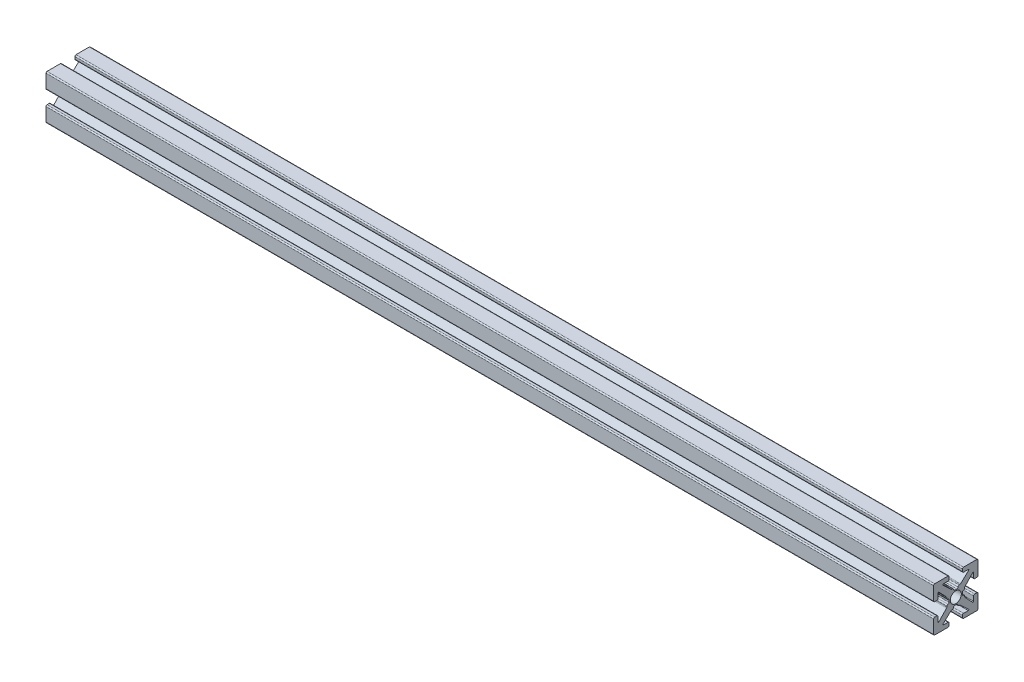
from build123d import *

# Parameters (mm, degrees)
ESTRUSIONE_ESTRUSIONE1_DEPTH = 200
FORO_FILETTATO_M3X0_5_1_D    = 2.5


with BuildPart() as part:
    # Sketch1 → Estrusione-Estrusione1 (new body)
    with BuildSketch(Plane(origin=(0, 0, 0), x_dir=(0, 0, -1), z_dir=(1, 0, 0))):
        with BuildLine():
            Line((-0.2413, 1.4986), (0.2413, 1.4986))
            ThreePointArc((0.2413, 1.4986), (0.420905122, 1.572994878), (0.4953, 1.7526))
            ThreePointArc((0.4953, 1.7526), (0.569694878, 1.932205122), (0.7493, 2.0066))
            Line((0.7493, 2.0066), (0.889923986, 2.0066))
            ThreePointArc((0.889923986, 2.0066), (0.983516259, 2.024471886), (1.063937899, 2.075572548))
            Line((1.063937899, 2.075572548), (2.890793, 3.793686274))
            ThreePointArc((2.890793, 3.793686274), (2.921850101, 3.932996137), (2.803786044, 4.0132))
            Line((2.803786044, 4.0132), (1.7526, 4.0132))
            ThreePointArc((1.7526, 4.0132), (1.572994878, 4.087594878), (1.4986, 4.2672))
            Line((1.4986, 4.2672), (1.4986, 4.7498))
            ThreePointArc((1.4986, 4.7498), (1.572994878, 4.929405122), (1.7526, 5.0038))
            Line((1.7526, 5.0038), (4.7498, 5.0038))
            ThreePointArc((4.7498, 5.0038), (4.929405122, 4.929405122), (5.0038, 4.7498))
            Line((5.0038, 4.7498), (5.0038, 1.7526))
            ThreePointArc((5.0038, 1.7526), (4.929405122, 1.572994878), (4.7498, 1.4986))
            Line((4.7498, 1.4986), (4.2672, 1.4986))
            ThreePointArc((4.2672, 1.4986), (4.087594878, 1.572994878), (4.0132, 1.7526))
            Line((4.0132, 1.7526), (4.0132, 2.803786044))
            ThreePointArc((4.0132, 2.803786044), (3.932996137, 2.921850101), (3.793686274, 2.890793))
            Line((3.793686274, 2.890793), (2.075572548, 1.063937899))
            ThreePointArc((2.075572548, 1.063937899), (2.024471886, 0.983516259), (2.0066, 0.889923986))
            Line((2.0066, 0.889923986), (2.0066, 0.7493))
            ThreePointArc((2.0066, 0.7493), (1.932205122, 0.569694878), (1.7526, 0.4953))
            ThreePointArc((1.7526, 0.4953), (1.572994878, 0.420905122), (1.4986, 0.2413))
            Line((1.4986, 0.2413), (1.4986, -0.2413))
            ThreePointArc((1.4986, -0.2413), (1.572994878, -0.420905122), (1.7526, -0.4953))
            ThreePointArc((1.7526, -0.4953), (1.932205122, -0.569694878), (2.0066, -0.7493))
            Line((2.0066, -0.7493), (2.0066, -0.889923986))
            ThreePointArc((2.0066, -0.889923986), (2.024471886, -0.983516259), (2.075572548, -1.063937899))
            Line((2.075572548, -1.063937899), (3.793686274, -2.890793))
            ThreePointArc((3.793686274, -2.890793), (3.932996137, -2.921850101), (4.0132, -2.803786044))
            Line((4.0132, -2.803786044), (4.0132, -1.7526))
            ThreePointArc((4.0132, -1.7526), (4.087594878, -1.572994878), (4.2672, -1.4986))
            Line((4.2672, -1.4986), (4.7498, -1.4986))
            ThreePointArc((4.7498, -1.4986), (4.929405122, -1.572994878), (5.0038, -1.7526))
            Line((5.0038, -1.7526), (5.0038, -4.7498))
            ThreePointArc((5.0038, -4.7498), (4.929405122, -4.929405122), (4.7498, -5.0038))
            Line((4.7498, -5.0038), (1.7526, -5.0038))
            ThreePointArc((1.7526, -5.0038), (1.572994878, -4.929405122), (1.4986, -4.7498))
            Line((1.4986, -4.7498), (1.4986, -4.2672))
            ThreePointArc((1.4986, -4.2672), (1.572994878, -4.087594878), (1.7526, -4.0132))
            Line((1.7526, -4.0132), (2.803786044, -4.0132))
            ThreePointArc((2.803786044, -4.0132), (2.921850101, -3.932996137), (2.890793, -3.793686274))
            Line((2.890793, -3.793686274), (1.063937899, -2.075572548))
            ThreePointArc((1.063937899, -2.075572548), (0.983516259, -2.024471886), (0.889923986, -2.0066))
            Line((0.889923986, -2.0066), (0.7493, -2.0066))
            ThreePointArc((0.7493, -2.0066), (0.569694878, -1.932205122), (0.4953, -1.7526))
            ThreePointArc((0.4953, -1.7526), (0.420905122, -1.572994878), (0.2413, -1.4986))
            Line((0.2413, -1.4986), (-0.2413, -1.4986))
            ThreePointArc((-0.2413, -1.4986), (-0.420905122, -1.572994878), (-0.4953, -1.7526))
            ThreePointArc((-0.4953, -1.7526), (-0.569694878, -1.932205122), (-0.7493, -2.0066))
            Line((-0.7493, -2.0066), (-0.889923986, -2.0066))
            ThreePointArc((-0.889923986, -2.0066), (-0.983516259, -2.024471886), (-1.063937899, -2.075572548))
            Line((-1.063937899, -2.075572548), (-2.890793, -3.793686274))
            ThreePointArc((-2.890793, -3.793686274), (-2.921850101, -3.932996137), (-2.803786044, -4.0132))
            Line((-2.803786044, -4.0132), (-1.7526, -4.0132))
            ThreePointArc((-1.7526, -4.0132), (-1.572994878, -4.087594878), (-1.4986, -4.2672))
            Line((-1.4986, -4.2672), (-1.4986, -4.7498))
            ThreePointArc((-1.4986, -4.7498), (-1.572994878, -4.929405122), (-1.7526, -5.0038))
            Line((-1.7526, -5.0038), (-4.7498, -5.0038))
            ThreePointArc((-4.7498, -5.0038), (-4.929405122, -4.929405122), (-5.0038, -4.7498))
            Line((-5.0038, -4.7498), (-5.0038, -1.7526))
            ThreePointArc((-5.0038, -1.7526), (-4.929405122, -1.572994878), (-4.7498, -1.4986))
            Line((-4.7498, -1.4986), (-4.2672, -1.4986))
            ThreePointArc((-4.2672, -1.4986), (-4.087594878, -1.572994878), (-4.0132, -1.7526))
            Line((-4.0132, -1.7526), (-4.0132, -2.803786044))
            ThreePointArc((-4.0132, -2.803786044), (-3.932996137, -2.921850101), (-3.793686274, -2.890793))
            Line((-3.793686274, -2.890793), (-2.075572548, -1.063937899))
            ThreePointArc((-2.075572548, -1.063937899), (-2.024471886, -0.983516259), (-2.0066, -0.889923986))
            Line((-2.0066, -0.889923986), (-2.0066, -0.7493))
            ThreePointArc((-2.0066, -0.7493), (-1.932205122, -0.569694878), (-1.7526, -0.4953))
            ThreePointArc((-1.7526, -0.4953), (-1.572994878, -0.420905122), (-1.4986, -0.2413))
            Line((-1.4986, -0.2413), (-1.4986, 0.2413))
            ThreePointArc((-1.4986, 0.2413), (-1.572994878, 0.420905122), (-1.7526, 0.4953))
            ThreePointArc((-1.7526, 0.4953), (-1.932205122, 0.569694878), (-2.0066, 0.7493))
            Line((-2.0066, 0.7493), (-2.0066, 0.889923986))
            ThreePointArc((-2.0066, 0.889923986), (-2.024471886, 0.983516259), (-2.075572548, 1.063937899))
            Line((-2.075572548, 1.063937899), (-3.793686274, 2.890793))
            ThreePointArc((-3.793686274, 2.890793), (-3.932996137, 2.921850101), (-4.0132, 2.803786044))
            Line((-4.0132, 2.803786044), (-4.0132, 1.7526))
            ThreePointArc((-4.0132, 1.7526), (-4.087594878, 1.572994878), (-4.2672, 1.4986))
            Line((-4.2672, 1.4986), (-4.7498, 1.4986))
            ThreePointArc((-4.7498, 1.4986), (-4.929405122, 1.572994878), (-5.0038, 1.7526))
            Line((-5.0038, 1.7526), (-5.0038, 4.7498))
            ThreePointArc((-5.0038, 4.7498), (-4.929405122, 4.929405122), (-4.7498, 5.0038))
            Line((-4.7498, 5.0038), (-1.7526, 5.0038))
            ThreePointArc((-1.7526, 5.0038), (-1.572994878, 4.929405122), (-1.4986, 4.7498))
            Line((-1.4986, 4.7498), (-1.4986, 4.2672))
            ThreePointArc((-1.4986, 4.2672), (-1.572994878, 4.087594878), (-1.7526, 4.0132))
            Line((-1.7526, 4.0132), (-2.803786044, 4.0132))
            ThreePointArc((-2.803786044, 4.0132), (-2.921850101, 3.932996137), (-2.890793, 3.793686274))
            Line((-2.890793, 3.793686274), (-1.063937899, 2.075572548))
            ThreePointArc((-1.063937899, 2.075572548), (-0.983516259, 2.024471886), (-0.889923986, 2.0066))
            Line((-0.889923986, 2.0066), (-0.7493, 2.0066))
            ThreePointArc((-0.7493, 2.0066), (-0.569694878, 1.932205122), (-0.4953, 1.7526))
            ThreePointArc((-0.4953, 1.7526), (-0.420905122, 1.572994878), (-0.2413, 1.4986))
        make_face()
    extrude(amount=ESTRUSIONE_ESTRUSIONE1_DEPTH)

    # Foro filettato M3x0.5-1 (through all)
    with Locations(Plane.ZY):
        with Locations((0, 0)):
            Hole(FORO_FILETTATO_M3X0_5_1_D / 2)


solid = part.part
